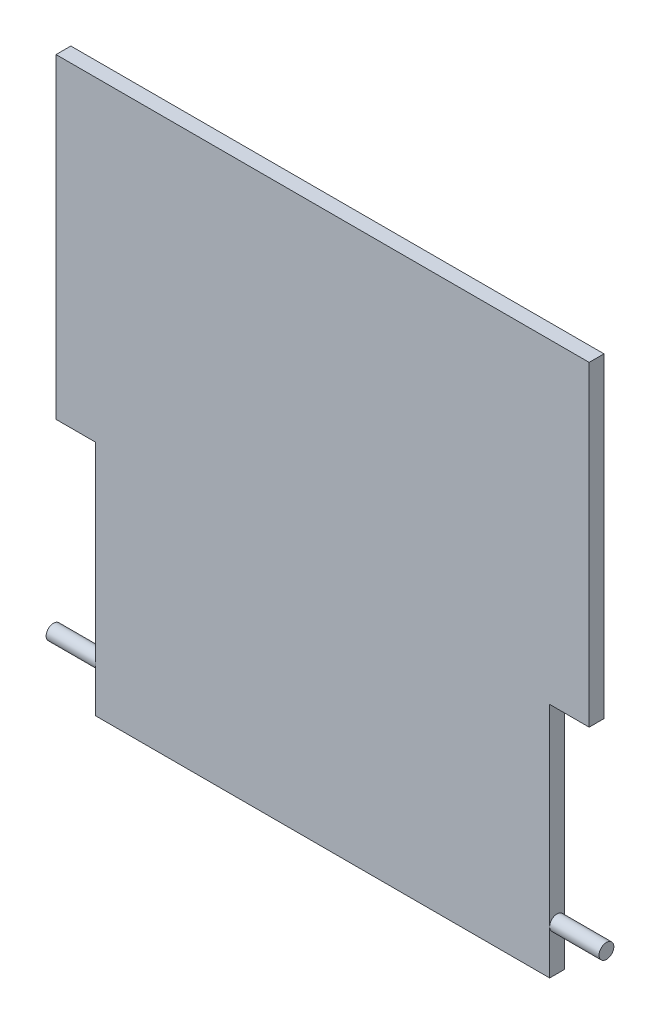
from build123d import *

# Parameters (mm, degrees)
BOSS_EXTRUDE1_DEPTH = 0.5953125
SKETCH2_R           = 0.5953125
BOSS_EXTRUDE2_DEPTH = 22.225


with BuildPart() as part:
    # Sketch1 → Boss-Extrude1 (new, symmetric)
    with BuildSketch(Plane.XY):
        Polygon((-18.25625, 0), (18.25625, 0), (18.25625, 19.05), (21.43125, 19.05), (21.43125, 44.45), (-21.43125, 44.45), (-21.43125, 19.05), (-18.25625, 19.05), align=None)
    extrude(amount=BOSS_EXTRUDE1_DEPTH, both=True)

    # Sketch2 → Boss-Extrude2 (add, symmetric)
    with BuildSketch(Plane(origin=(0, 0, 0), x_dir=(0, 0, -1), z_dir=(1, 0, 0))):
        with Locations((0, 3.571875)):
            Circle(SKETCH2_R)
    extrude(amount=BOSS_EXTRUDE2_DEPTH, both=True)


solid = part.part
